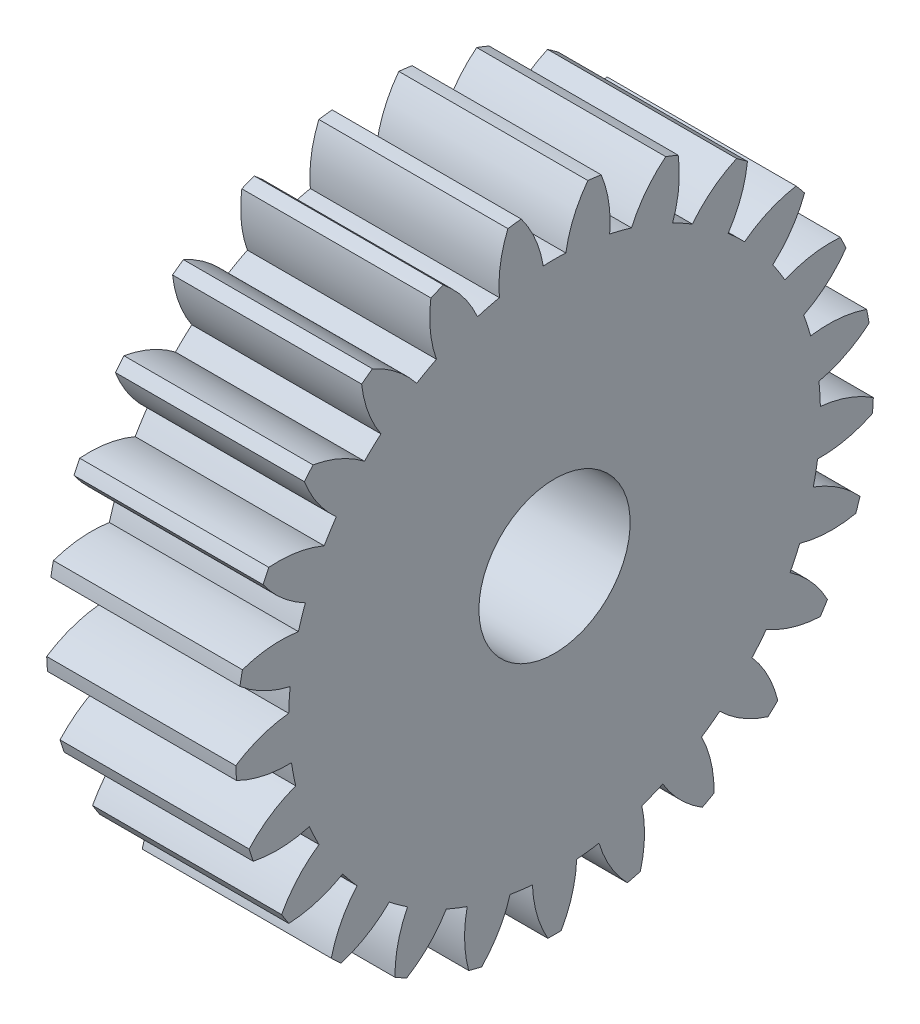
from build123d import *

# Parameters (mm, degrees)
BASPROSKE_W     = 10
BASPROSKE_H     = 16.875
TOOTHCUT_DEPTH  = 26.875301931
TEETHCUTS_COUNT = 25
TEETHCUTS_ANGLE = 345.6
BORSKE_R        = 4
BORE_DEPTH      = 50.0000508


with BuildPart() as part:
    # BasProSke → Base-Revolve (revolve)
    with BuildSketch(Plane(origin=(0, 0, 0), x_dir=(1, 0, 0), z_dir=(0, 1, 0)), mode=Mode.PRIVATE) as base_revolve_sk:
        with Locations((5, 8.4375)):
            Rectangle(BASPROSKE_W, BASPROSKE_H)
    revolve(base_revolve_sk.sketch.rotate(Axis((-10, 0, 0), (1, 0, 0)), 180), axis=Axis((-10, 0, 0), (1, 0, 0)))

    # TooCutSke → ToothCut (cut, through all)
    with BuildSketch(Plane(origin=(0, 0, 0), x_dir=(0, 0, -1), z_dir=(1, 0, 0))):
        with BuildLine():
            ThreePointArc((0.596210815, 14.048854577), (0, 14.0615), (-0.596210815, 14.048854577))
            ThreePointArc((-0.596210815, 14.048854577), (-1.020642781, 15.499746442), (-1.781013571, 16.806293786))
            ThreePointArc((-1.781013571, 16.806293786), (0, 16.9004), (1.781013571, 16.806293786))
            ThreePointArc((1.781013571, 16.806293786), (1.020642781, 15.499746442), (0.596210815, 14.048854577))
        make_face()
    toothcut = extrude(amount=TOOTHCUT_DEPTH, mode=Mode.SUBTRACT)

    # TeethCuts: ToothCut ×25 about axis
    teethcuts_axis = Axis((-10, 0, 0), (1, 0, 0))
    for i in range(1, TEETHCUTS_COUNT):
        add(toothcut.rotate(teethcuts_axis, i * TEETHCUTS_ANGLE / (TEETHCUTS_COUNT - 1)), mode=Mode.SUBTRACT)

    # BorSke → Bore (cut, symmetric)
    with BuildSketch(Plane(origin=(0, 0, 0), x_dir=(0, 0, -1), z_dir=(1, 0, 0))):
        with Locations(Location((0, 0, 0), (0, 0, 180))):
            Circle(BORSKE_R)
    extrude(amount=BORE_DEPTH, both=True, mode=Mode.SUBTRACT)


solid = part.part
